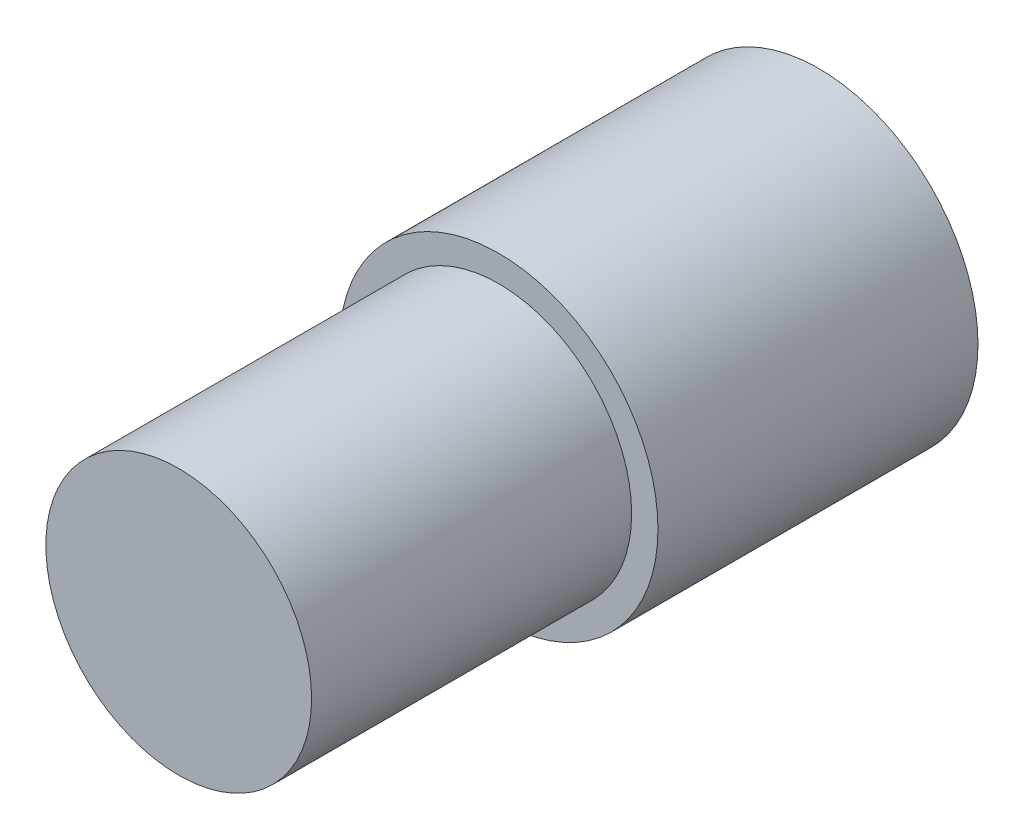
from build123d import *

# Parameters (mm, degrees)
SKETCH1_R           = 4.975
BOSS_EXTRUDE1_DEPTH = 10
SKETCH2_R           = 4.152007566
BOSS_EXTRUDE2_DEPTH = 10


with BuildPart() as part:
    # Sketch1 → Boss-Extrude1 (new body)
    with BuildSketch(Plane.XY):
        Circle(SKETCH1_R)
    extrude(amount=BOSS_EXTRUDE1_DEPTH)

    # Sketch2 → Boss-Extrude2 (add)
    with BuildSketch(Plane.XY.offset(10)):
        Circle(SKETCH2_R)
    extrude(amount=BOSS_EXTRUDE2_DEPTH)


solid = part.part
